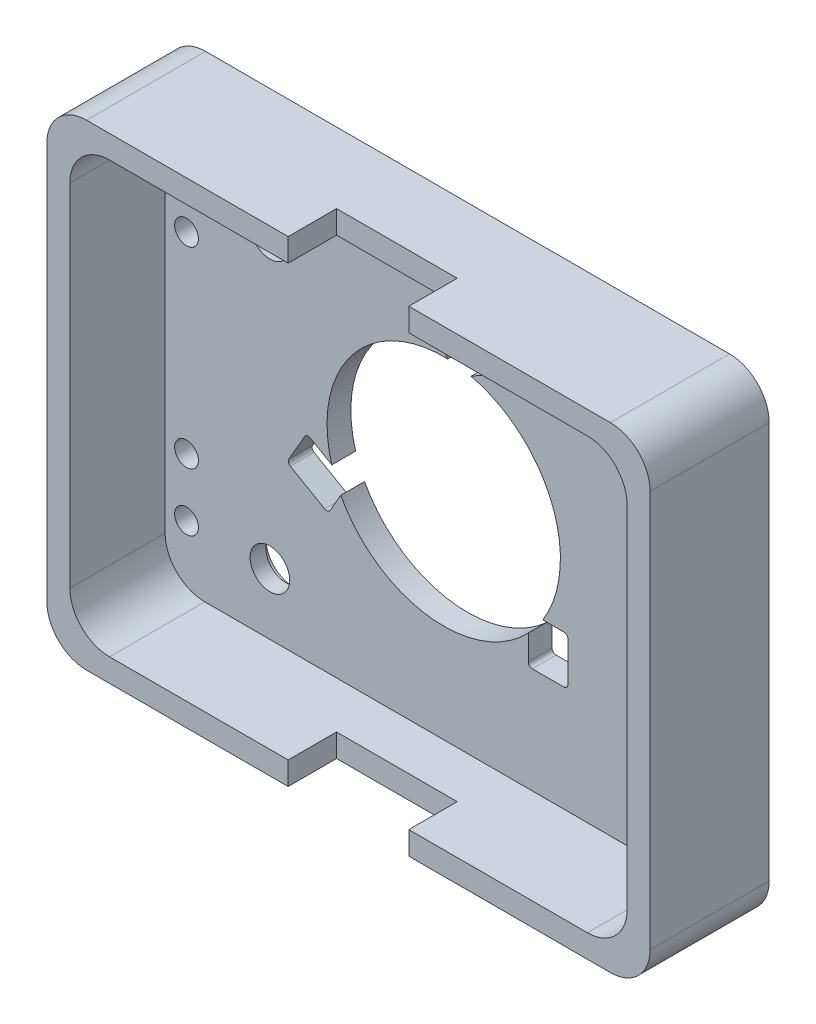
from build123d import *

# Parameters (mm, degrees)
EXTRUDE_1_DEPTH     = 15
CUT_EXTRUDE_1_DEPTH = 12
SKETCH_4_W          = 15.2
SKETCH_4_H          = 2.9
CUT_EXTRUDE_2_DEPTH = 6.1
SKETCH_5_R          = 1.5
CUT_EXTRUDE_3_DEPTH = 50.879855653
SKETCH_8_R          = 2.5
CUT_EXTRUDE_4_DEPTH = 50.879855653
SKETCH_9_R          = 3.5
SKETCH_9_R_2        = 4
CUT_EXTRUDE_6_DEPTH = 1


with BuildPart() as part:
    # 草圖1 → 填料-伸長1 (new body)
    with BuildSketch(Plane.XY):
        with BuildLine():
            Line((-33, 30), (33, 30))
            ThreePointArc((33, 30), (36.535533906, 28.535533906), (38, 25))
            Line((38, 25), (38, -25))
            ThreePointArc((38, -25), (36.535533906, -28.535533906), (33, -30))
            Line((33, -30), (-33, -30))
            ThreePointArc((-33, -30), (-36.535533906, -28.535533906), (-38, -25))
            Line((-38, -25), (-38, 25))
            ThreePointArc((-38, 25), (-36.535533906, 28.535533906), (-33, 30))
        make_face()
    extrude(amount=EXTRUDE_1_DEPTH)

    # 草圖2 → 除料-伸長1 (cut)
    with BuildSketch(Plane.XY.offset(15)):
        with BuildLine():
            Line((-30.1, 27.1), (30.1, 27.1))
            ThreePointArc((30.1, 27.1), (33.635533906, 25.635533906), (35.1, 22.1))
            Line((35.1, 22.1), (35.1, -22.1))
            ThreePointArc((35.1, -22.1), (33.635533906, -25.635533906), (30.1, -27.1))
            Line((30.1, -27.1), (-30.1, -27.1))
            ThreePointArc((-30.1, -27.1), (-33.635533906, -25.635533906), (-35.1, -22.1))
            Line((-35.1, -22.1), (-35.1, 22.1))
            ThreePointArc((-35.1, 22.1), (-33.635533906, 25.635533906), (-30.1, 27.1))
        make_face()
    extrude(amount=-CUT_EXTRUDE_1_DEPTH, mode=Mode.SUBTRACT)

    # 草圖3 → 除料-旋轉1 (revolve, cut)
    with BuildSketch(Plane(origin=(0, 0, 0), x_dir=(1, 0, 0), z_dir=(0, 1, 0)), mode=Mode.PRIVATE) as cut_revolve_1_sk:
        Polygon((0, -3), (14.7, -3), (14.7, -1.9), (14.7, 0), (0, 0), (0, -1.9), align=None)
    revolve(cut_revolve_1_sk.sketch.rotate(Axis((0, 0, -11.605627028), (0, 0, 1)), 180), axis=Axis((0, 0, -11.605627028), (0, 0, 1)), mode=Mode.SUBTRACT)

    # 草圖4 → 除料-伸長2 (cut)
    with BuildSketch(Plane.XY.offset(15)):
        with Locations((0, 28.55)):
            Rectangle(SKETCH_4_W, SKETCH_4_H)
        with Locations((0, -28.55)):
            Rectangle(SKETCH_4_W, SKETCH_4_H)
    extrude(amount=-CUT_EXTRUDE_2_DEPTH, mode=Mode.SUBTRACT)

    # 草圖5 → 除料-伸長3 (cut, through all)
    with BuildSketch(Plane.XY.offset(3)):
        with BuildLine():
            ThreePointArc((-0.654309657, 17.693297569), (-0.88727257, 17.38969439), (-0.837322359, 17.010284867))
            Line((-0.837322359, 17.010284867), (1.162677641, 13.546183252))
            ThreePointArc((1.162677641, 13.546183252), (1.725099866, 14.279146165), (1.845690343, 13.36317055))
            Line((1.845690343, 13.36317055), (6.175817362, 15.86317055))
            ThreePointArc((6.175817362, 15.86317055), (6.408780275, 16.16677373), (6.358830064, 16.546183252))
            Line((6.358830064, 16.546183252), (4.358830064, 20.010284867))
            ThreePointArc((4.358830064, 20.010284867), (4.055226885, 20.24324778), (3.675817362, 20.193297569))
            Line((3.675817362, 20.193297569), (-0.654309657, 17.693297569))
        make_face()
        with BuildLine():
            Line((-14.312677641, -9.230284867), (-12.312677641, -5.766183252))
            ThreePointArc((-12.312677641, -5.766183252), (-13.228653256, -5.645592775), (-12.495690343, -5.08317055))
            Line((-12.495690343, -5.08317055), (-16.825817362, -2.58317055))
            ThreePointArc((-16.825817362, -2.58317055), (-17.205226885, -2.533220339), (-17.508830064, -2.766183252))
            Line((-17.508830064, -2.766183252), (-19.508830064, -6.230284867))
            ThreePointArc((-19.508830064, -6.230284867), (-19.558780275, -6.60969439), (-19.325817362, -6.913297569))
            Line((-19.325817362, -6.913297569), (-14.995690343, -9.413297569))
            ThreePointArc((-14.995690343, -9.413297569), (-14.616280821, -9.46324778), (-14.312677641, -9.230284867))
        make_face()
        with BuildLine():
            Line((15.15, -7.78), (11.15, -7.78))
            ThreePointArc((11.15, -7.78), (10.796446609, -7.926446609), (10.65, -8.28))
            Line((10.65, -8.28), (10.65, -13.28))
            ThreePointArc((10.65, -13.28), (10.796446609, -13.633553391), (11.15, -13.78))
            Line((11.15, -13.78), (15.15, -13.78))
            ThreePointArc((15.15, -13.78), (15.503553391, -13.633553391), (15.65, -13.28))
            Line((15.65, -13.28), (15.65, -8.28))
            ThreePointArc((15.65, -8.28), (15.503553391, -7.926446609), (15.15, -7.78))
        make_face()
        with Locations((-32.4, 19.4)):
            Circle(SKETCH_5_R)
        with Locations((32.4, 17.9)):
            Circle(SKETCH_5_R)
        with Locations(Location((-32.4, -19.4, 0), (0, 0, 180))):
            Circle(SKETCH_5_R)
        with Locations((32.4, -19.4)):
            Circle(SKETCH_5_R)
        with Locations((-32.4, 12.1)):
            Circle(SKETCH_5_R)
        with Locations(Location((32.4, 12.1, 0), (0, 0, 180))):
            Circle(SKETCH_5_R)
        with Locations((32.4, -12.1)):
            Circle(SKETCH_5_R)
        with Locations(Location((-32.4, -12.1, 0), (0, 0, 180))):
            Circle(SKETCH_5_R)
    extrude(amount=-CUT_EXTRUDE_3_DEPTH, mode=Mode.SUBTRACT)

    # 草圖8 → 除料-伸長4 (cut, through all)
    with BuildSketch(Plane.XY.offset(3)):
        with Locations((-21.9, -19.4)):
            Circle(SKETCH_8_R)
        with Locations((21.9, 16.9)):
            Circle(SKETCH_8_R)
        with Locations(Location((-21.9, 16.9, 0), (0, 0, 180))):
            Circle(SKETCH_8_R)
    extrude(amount=-CUT_EXTRUDE_4_DEPTH, mode=Mode.SUBTRACT)

    # 草圖9 → 除料-伸長6 (cut)
    with BuildSketch(Plane(origin=(0, 0, 0), x_dir=(-1, 0, 0), z_dir=(0, 0, -1))):
        with Locations((-21.9, 16.9)):
            Circle(SKETCH_9_R)
        with Locations((21.9, -19.4)):
            Circle(SKETCH_9_R)
        with Locations((21.9, 16.9)):
            Circle(SKETCH_9_R_2)
    extrude(amount=-CUT_EXTRUDE_6_DEPTH, mode=Mode.SUBTRACT)


solid = part.part
